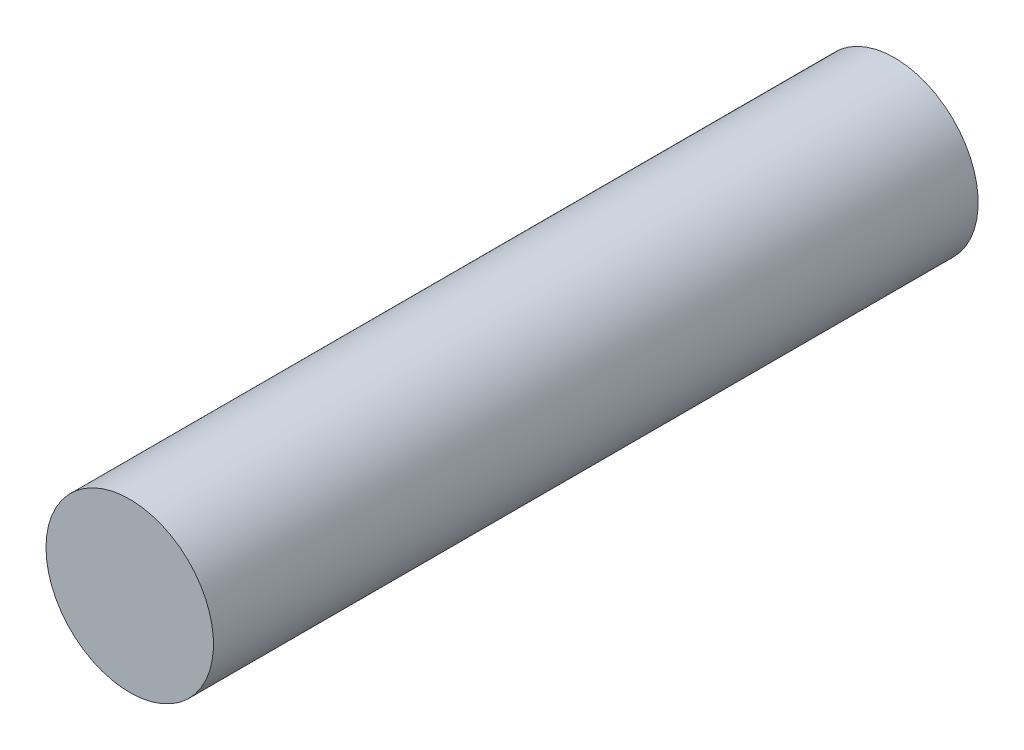
from build123d import *

# Parameters (mm, degrees)
SKETCH_1_R      = 1.5
EXTRUDE_1_DEPTH = 13.7


with BuildPart() as part:
    # 스케치1 → 보스-돌출1 (new body)
    with BuildSketch(Plane.XY):
        with Locations(Location((0, 0, 0), (0, 0, 180))):
            Circle(SKETCH_1_R)
    extrude(amount=EXTRUDE_1_DEPTH)


solid = part.part
